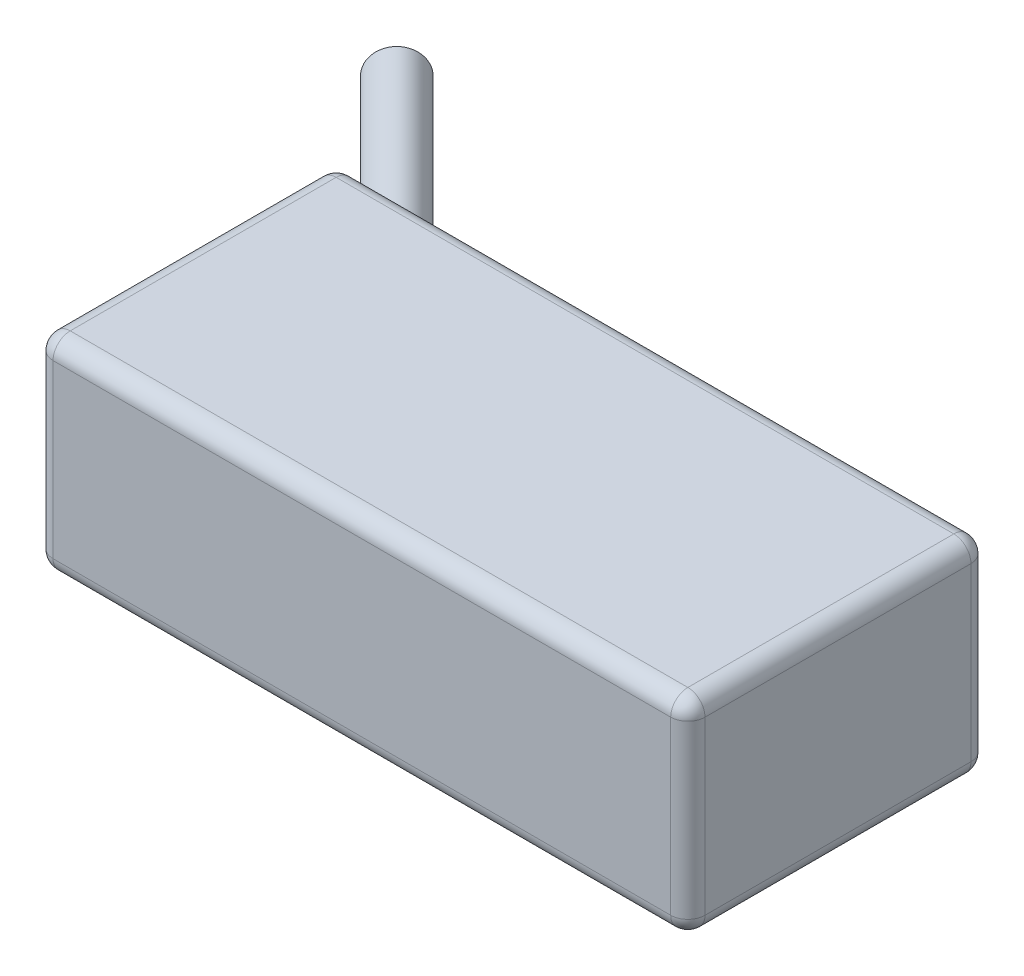
from build123d import *

# Parameters (mm, degrees)
SKETCH1_W           = 76
SKETCH1_H           = 35
BOSS_EXTRUDE1_DEPTH = 12
SKETCH4_R           = 3
BOSS_EXTRUDE2_DEPTH = 30
FILLET1_R           = 2


with BuildPart() as part:
    # Sketch1 → Boss-Extrude1 (new, symmetric)
    with BuildSketch(Plane(origin=(0, 0, 0), x_dir=(1, 0, 0), z_dir=(0, 1, 0))):
        Rectangle(SKETCH1_W, SKETCH1_H)
    extrude(amount=BOSS_EXTRUDE1_DEPTH, both=True)

    # Sketch4 → Boss-Extrude2 (add)
    with BuildSketch(Plane(origin=(-22.75, 0, -22.75), x_dir=(0.7071067811865509, 0, -0.7071067811865442), z_dir=(0.7071067811865442, 0, 0.7071067811865509))):
        with Locations((-9.495689014, 4)):
            Circle(SKETCH4_R)
        with Locations((-9.495689014, -4)):
            Circle(SKETCH4_R)
    extrude(amount=-BOSS_EXTRUDE2_DEPTH)

    # Fillet1
    fillet1_edges = [part.edges().sort_by_distance(p)[0] for p in [
        (38, 0, -17.5),
        (-38, 0, -17.5),
        (-38, 0, 17.5),
        (38, 0, 17.5),
        (0, -12, -17.5),
        (-38, -12, 0),
        (0, -12, 17.5),
        (38, -12, 0),
        (0, 12, 17.5),
        (-38, 12, 0),
        (0, 12, -17.5),
        (38, 12, 0),
    ]]
    fillet(fillet1_edges, radius=FILLET1_R)


solid = part.part
